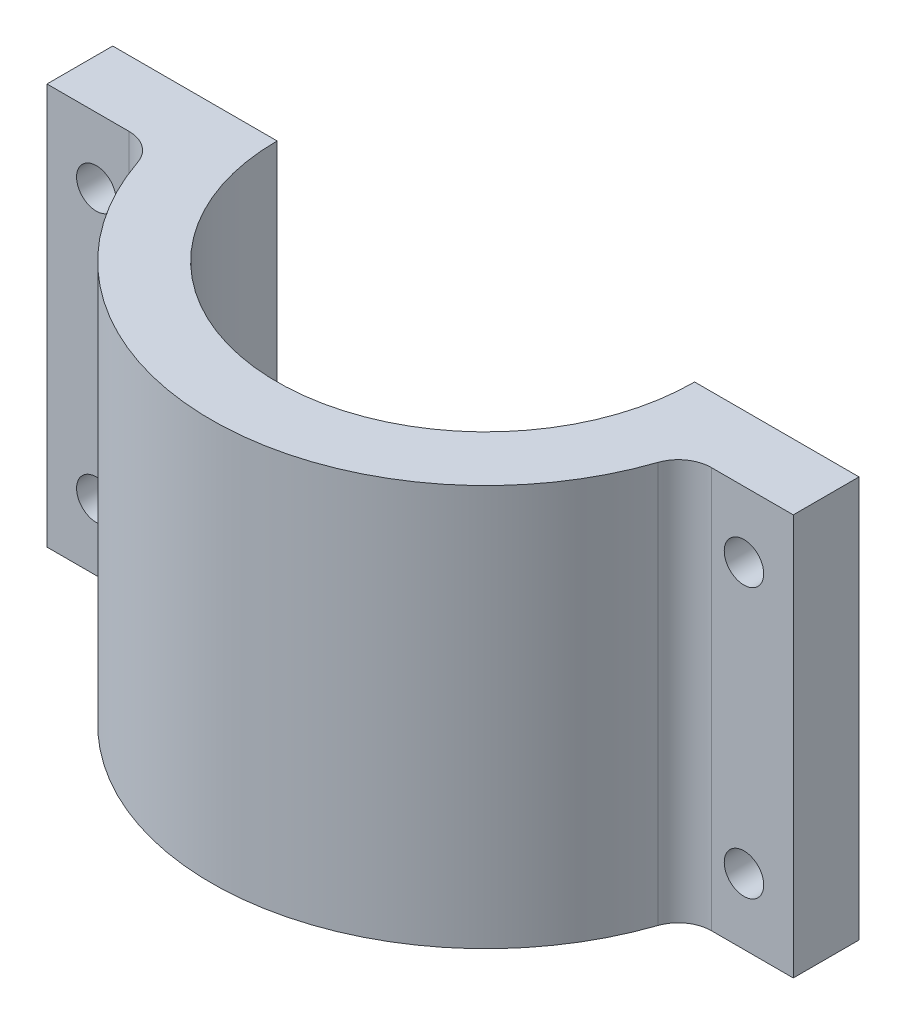
from build123d import *

# Parameters (mm, degrees)
BOSS_EXTRUDE1_DEPTH = 61
SKETCH2_R           = 3
CUT_EXTRUDE1_DEPTH  = 90.16066958
FILLET1_R           = 5


with BuildPart() as part:
    # Sketch1 → Boss-Extrude1 (new body)
    with BuildSketch(Plane(origin=(0, 0, 0), x_dir=(1, 0, 0), z_dir=(0, 1, 0))):
        with BuildLine():
            Line((-31.75, 0), (-41.75, 0))
            Line((-41.75, 0), (-56.75, 0))
            Line((-56.75, 0), (-56.75, -10))
            Line((-56.75, -10), (-40.534707351, -10))
            ThreePointArc((-40.534707351, -10), (0, -41.75), (40.534707351, -10))
            Line((40.534707351, -10), (56.75, -10))
            Line((56.75, -10), (56.75, 0))
            Line((56.75, 0), (41.75, 0))
            Line((41.75, 0), (31.75, 0))
            ThreePointArc((31.75, 0), (0, -31.75), (-31.75, 0))
        make_face()
    extrude(amount=BOSS_EXTRUDE1_DEPTH)

    # Sketch2 → Cut-Extrude1 (cut, through all)
    with BuildSketch(Plane.XY.offset(10)):
        with Locations((-49.25, 51)):
            Circle(SKETCH2_R)
        with Locations((-49.25, 10)):
            Circle(SKETCH2_R)
        with Locations(Location((49.25, 10, 0), (0, 0, 180))):
            Circle(SKETCH2_R)
        with Locations(Location((49.25, 51, 0), (0, 0, 180))):
            Circle(SKETCH2_R)
    extrude(amount=-CUT_EXTRUDE1_DEPTH, mode=Mode.SUBTRACT)

    # Fillet1
    fillet1_edges = [part.edges().sort_by_distance(p)[0] for p in [
        (40.534707351, 30.5, 10),
        (-40.534707351, 30.5, 10),
    ]]
    fillet(fillet1_edges, radius=FILLET1_R)


solid = part.part
